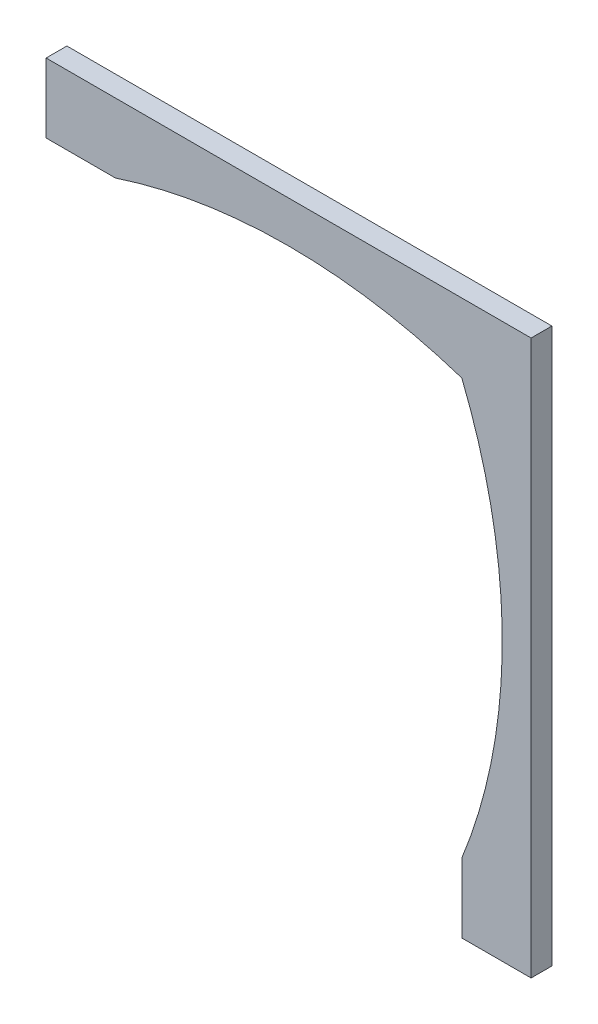
from build123d import *

# Parameters (mm, degrees)
BOSS_EXTRUDE1_DEPTH = 3


with BuildPart() as part:
    # Sketch1 → Boss-Extrude1 (new body)
    with BuildSketch(Plane.XY):
        with BuildLine():
            Line((0, 0), (-70, 0))
            Line((-70, 0), (-70, -10))
            Line((-70, -10), (-60, -10))
            ThreePointArc((-60, -10), (-35, -5.993420768), (-10, -10))
            ThreePointArc((-10, -10), (-4.161984871, -40), (-10, -70))
            Line((-10, -70), (-10, -80))
            Line((-10, -80), (0, -80))
            Line((0, -80), (0, 0))
        make_face()
    extrude(amount=BOSS_EXTRUDE1_DEPTH)


solid = part.part
